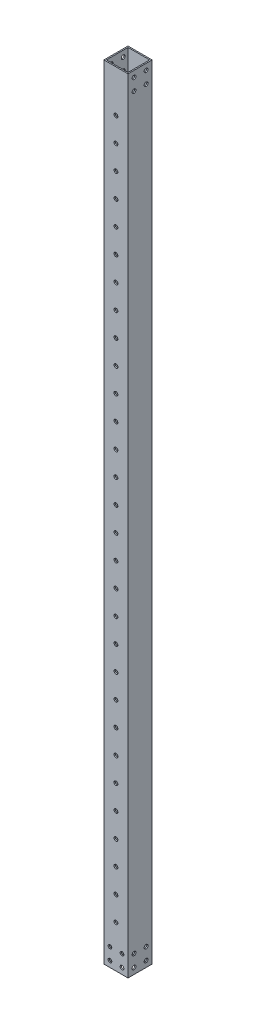
from build123d import *

# Parameters (mm, degrees)
SKETCH_1_W          = 20
SKETCH_1_H          = 20
SKETCH_1_W_2        = 18
SKETCH_1_H_2        = 18
EXTRUDE_1_DEPTH     = 650
SKETCH_3_R          = 1.6
CUT_EXTRUDE_1_DEPTH = 651.38450166
SKETCH_4_R          = 1.6
CUT_EXTRUDE_2_DEPTH = 651.38450166
SKETCH_5_R          = 1.55
CUT_EXTRUDE_3_DEPTH = 651.38450166


with BuildPart() as part:
    # 草图1 → 拉伸-薄壁1 (new body)
    with BuildSketch(Plane(origin=(0, 0, 0), x_dir=(1, 0, 0), z_dir=(0, 1, 0))):
        Rectangle(SKETCH_1_W, SKETCH_1_H)
        Rectangle(SKETCH_1_W_2, SKETCH_1_H_2, mode=Mode.SUBTRACT)
    extrude(amount=EXTRUDE_1_DEPTH)

    # 草图3 → 切除-拉伸1 (cut, through all)
    with BuildSketch(Plane(origin=(10, 0, 0), x_dir=(0, 0, -1), z_dir=(1, 0, 0))):
        with Locations((-5, 15)):
            Circle(SKETCH_3_R)
        with Locations((-5, 5)):
            Circle(SKETCH_3_R)
        with Locations((5, 5)):
            Circle(SKETCH_3_R)
        with Locations((5, 15)):
            Circle(SKETCH_3_R)
        with Locations((5, 635)):
            Circle(SKETCH_3_R)
        with Locations((5, 645)):
            Circle(SKETCH_3_R)
        with Locations((-5, 645)):
            Circle(SKETCH_3_R)
        with Locations((-5, 635)):
            Circle(SKETCH_3_R)
    extrude(amount=-CUT_EXTRUDE_1_DEPTH, mode=Mode.SUBTRACT)

    # 草图4 → 切除-拉伸2 (cut, through all)
    with BuildSketch(Plane.XY.offset(10)):
        with Locations((0, 35)):
            Circle(SKETCH_4_R)
        with Locations((0, 55)):
            Circle(SKETCH_4_R)
        with Locations((0, 75)):
            Circle(SKETCH_4_R)
        with Locations((0, 95)):
            Circle(SKETCH_4_R)
        with Locations((0, 115)):
            Circle(SKETCH_4_R)
        with Locations((0, 135)):
            Circle(SKETCH_4_R)
        with Locations((0, 155)):
            Circle(SKETCH_4_R)
        with Locations((0, 175)):
            Circle(SKETCH_4_R)
        with Locations((0, 195)):
            Circle(SKETCH_4_R)
        with Locations((0, 215)):
            Circle(SKETCH_4_R)
        with Locations((0, 235)):
            Circle(SKETCH_4_R)
        with Locations((0, 255)):
            Circle(SKETCH_4_R)
        with Locations((0, 275)):
            Circle(SKETCH_4_R)
        with Locations((0, 295)):
            Circle(SKETCH_4_R)
        with Locations((0, 315)):
            Circle(SKETCH_4_R)
        with Locations((0, 335)):
            Circle(SKETCH_4_R)
        with Locations((0, 355)):
            Circle(SKETCH_4_R)
        with Locations((0, 375)):
            Circle(SKETCH_4_R)
        with Locations((0, 395)):
            Circle(SKETCH_4_R)
        with Locations((0, 415)):
            Circle(SKETCH_4_R)
        with Locations((0, 435)):
            Circle(SKETCH_4_R)
        with Locations((0, 455)):
            Circle(SKETCH_4_R)
        with Locations((0, 475)):
            Circle(SKETCH_4_R)
        with Locations((0, 495)):
            Circle(SKETCH_4_R)
        with Locations((0, 515)):
            Circle(SKETCH_4_R)
        with Locations((0, 535)):
            Circle(SKETCH_4_R)
        with Locations((0, 555)):
            Circle(SKETCH_4_R)
        with Locations((0, 575)):
            Circle(SKETCH_4_R)
        with Locations((0, 595)):
            Circle(SKETCH_4_R)
        with Locations((0, 615)):
            Circle(SKETCH_4_R)
    extrude(amount=-CUT_EXTRUDE_2_DEPTH, mode=Mode.SUBTRACT)

    # 草图5 → 切除-拉伸3 (cut, through all)
    with BuildSketch(Plane.XY.offset(10)):
        with Locations((-5, 15)):
            Circle(SKETCH_5_R)
        with Locations(Location((-5, 5, 0), (0, 0, 180))):
            Circle(SKETCH_5_R)
        with Locations((5, 5)):
            Circle(SKETCH_5_R)
        with Locations(Location((5, 15, 0), (0, 0, 180))):
            Circle(SKETCH_5_R)
    extrude(amount=-CUT_EXTRUDE_3_DEPTH, mode=Mode.SUBTRACT)


solid = part.part
